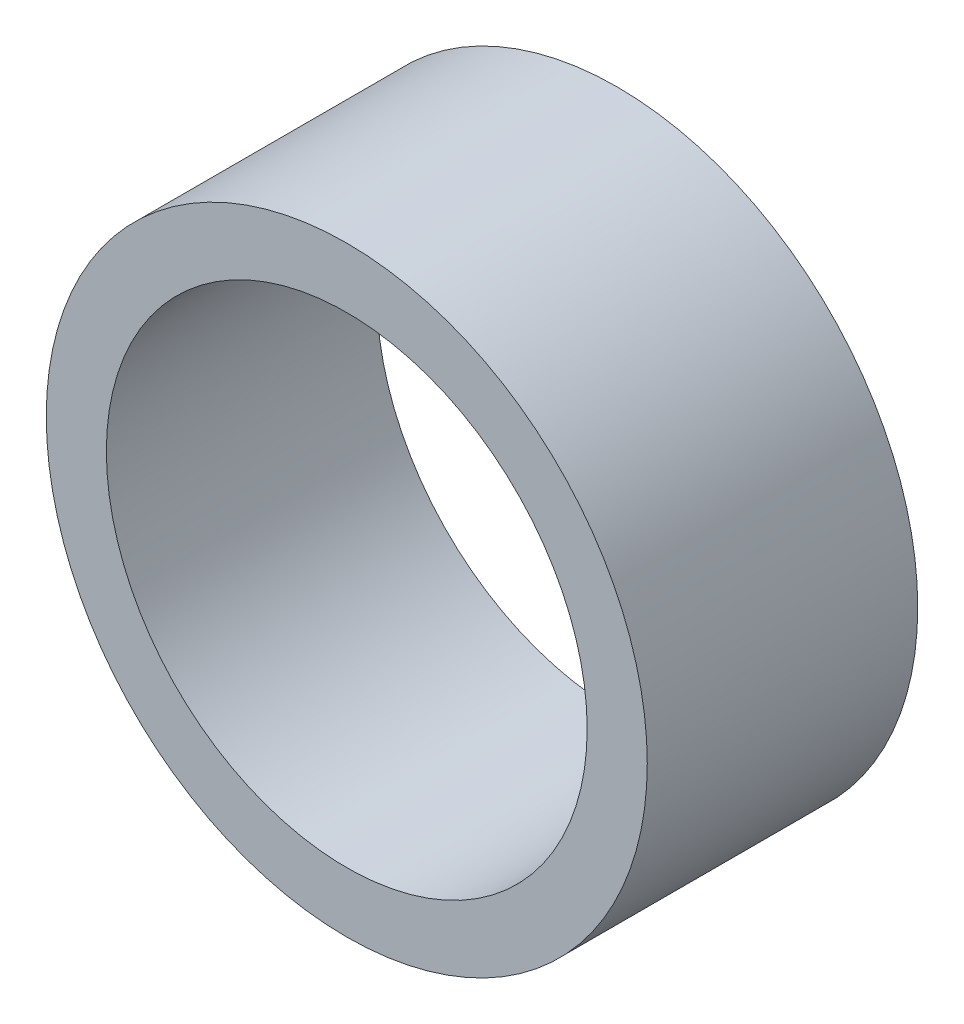
from build123d import *

# Parameters (mm, degrees)
SKETCH_1_R      = 20
SKETCH_1_R_2    = 16
EXTRUDE_1_DEPTH = 9


with BuildPart() as part:
    # 草图1 → 凸台-拉伸1 (new, symmetric)
    with BuildSketch(Plane.XY):
        Circle(SKETCH_1_R)
        Circle(SKETCH_1_R_2, mode=Mode.SUBTRACT)
    extrude(amount=EXTRUDE_1_DEPTH, both=True)


solid = part.part
